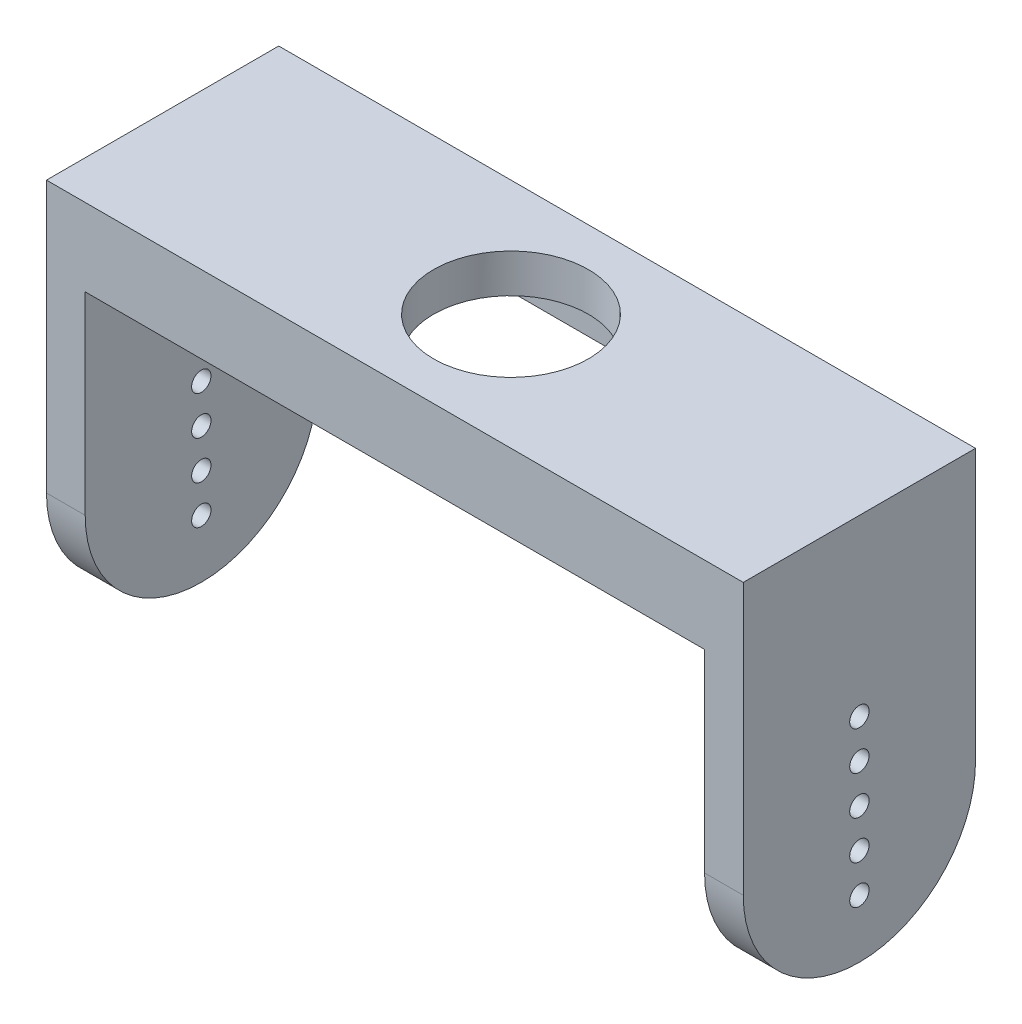
from build123d import *

# Parameters (mm, degrees)
SKETCH1_W           = 36
SKETCH1_H           = 20
BOSS_EXTRUDE1_DEPTH = 12
SKETCH3_W           = 32
SKETCH3_H           = 16
CUT_EXTRUDE1_DEPTH  = 12
SKETCH4_W           = 32
SKETCH4_H           = 12
CUT_EXTRUDE2_DEPTH  = 12
CUT_EXTRUDE3_DEPTH  = 40.242833741
SKETCH5_R           = 4
CUT_EXTRUDE4_DEPTH  = 10
SKETCH6_R           = 0.5
CUT_EXTRUDE5_DEPTH  = 40.242833741
SKETCH7_W           = 32
SKETCH7_H           = 1
BOSS_EXTRUDE2_DEPTH = 2


with BuildPart() as part:
    # Sketch1 → Boss-Extrude1 (new body)
    with BuildSketch(Plane.XY):
        Rectangle(SKETCH1_W, SKETCH1_H)
    extrude(amount=BOSS_EXTRUDE1_DEPTH)

    # Sketch3 → Cut-Extrude1 (cut)
    with BuildSketch(Plane.XY.offset(12)):
        Rectangle(SKETCH3_W, SKETCH3_H)
    extrude(amount=-CUT_EXTRUDE1_DEPTH, mode=Mode.SUBTRACT)

    # Sketch4 → Cut-Extrude2 (cut)
    with BuildSketch(Plane(origin=(0, -8, 0), x_dir=(1, 0, 0), z_dir=(0, 1, 0))):
        with Locations((0, -6)):
            Rectangle(SKETCH4_W, SKETCH4_H)
    extrude(amount=-CUT_EXTRUDE2_DEPTH, mode=Mode.SUBTRACT)

    # Sketch2 → Cut-Extrude3 (cut, through all)
    with BuildSketch(Plane(origin=(18, 0, 0), x_dir=(0, 0, -1), z_dir=(1, 0, 0))):
        with BuildLine():
            Line((-12, -10), (-6, -10))
            ThreePointArc((-6, -10), (-10.242640687, -8.242640687), (-12, -4))
            Line((-12, -4), (-12, -10))
        make_face()
        with BuildLine():
            Line((-6, -10), (0, -10))
            Line((0, -10), (0, -4))
            ThreePointArc((0, -4), (-1.757359313, -8.242640687), (-6, -10))
        make_face()
    extrude(amount=-CUT_EXTRUDE3_DEPTH, mode=Mode.SUBTRACT)

    # Sketch5 → Cut-Extrude4 (cut)
    with BuildSketch(Plane(origin=(0, 10, 0), x_dir=(1, 0, 0), z_dir=(0, 1, 0))):
        with Locations(Location((0, -6, 0), (0, 0, 270))):
            Circle(SKETCH5_R)
    extrude(amount=-CUT_EXTRUDE4_DEPTH, mode=Mode.SUBTRACT)

    # Sketch6 → Cut-Extrude5 (cut, through all)
    with BuildSketch(Plane(origin=(18, 0, 0), x_dir=(0, 0, -1), z_dir=(1, 0, 0))):
        with Locations((-6, -7)):
            Circle(SKETCH6_R)
        with Locations((-6, -5)):
            Circle(SKETCH6_R)
        with Locations((-6, -3)):
            Circle(SKETCH6_R)
        with Locations((-6, -1)):
            Circle(SKETCH6_R)
        with Locations((-6, 1)):
            Circle(SKETCH6_R)
    extrude(amount=-CUT_EXTRUDE5_DEPTH, mode=Mode.SUBTRACT)

    # Sketch7 → Boss-Extrude2 (add)
    with BuildSketch(Plane.XZ.offset(-8)):
        with Locations((0, 11.5)):
            Rectangle(SKETCH7_W, SKETCH7_H)
        with Locations((0, 0.5)):
            Rectangle(SKETCH7_W, SKETCH7_H)
    extrude(amount=BOSS_EXTRUDE2_DEPTH)


solid = part.part
